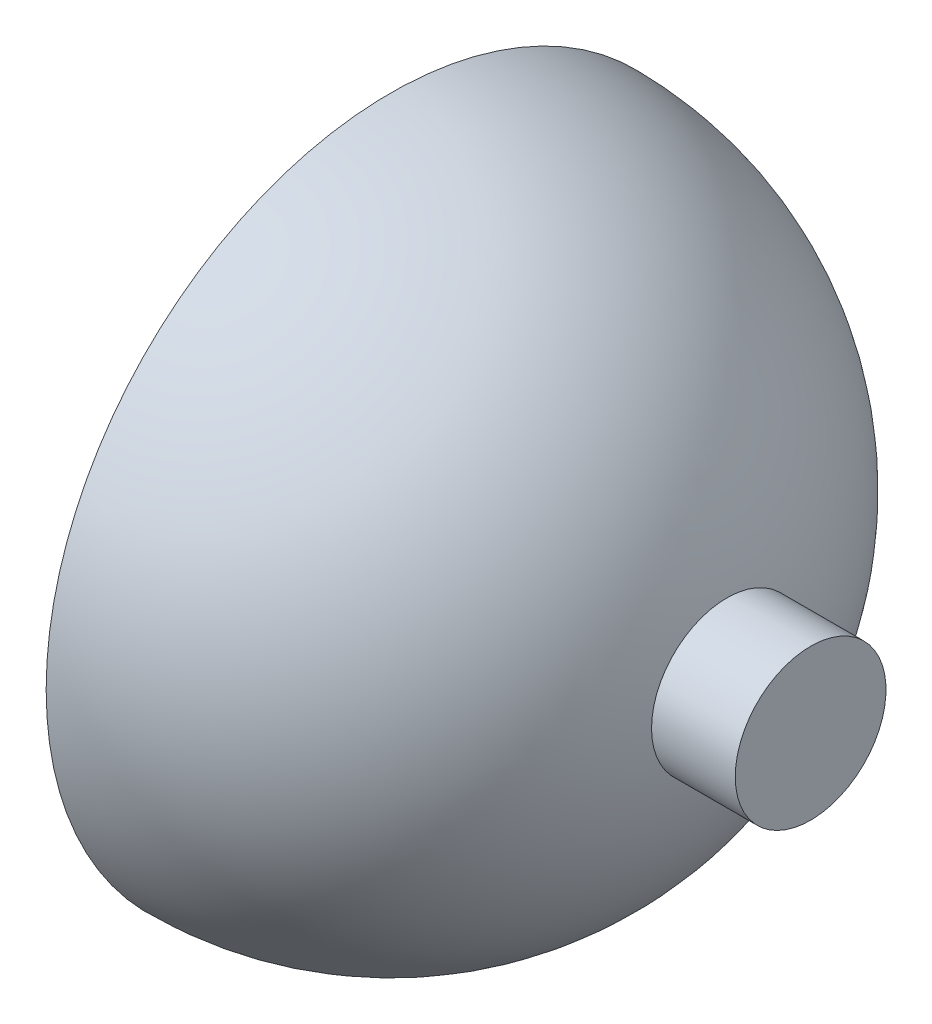
from build123d import *


with BuildPart() as part:
    # Sketch1 → Revolve4 (revolve)
    with BuildSketch(Plane.XY, mode=Mode.PRIVATE) as revolve4_sk:
        with BuildLine():
            ThreePointArc((0, 28.38), (20.06769045, 20.06769045), (28.38, 0))
            Line((28.38, 0), (32, 0))
            Line((32, 0), (39, 0))
            Line((39, 0), (39, 7))
            Line((39, 7), (31.224989992, 7))
            ThreePointArc((31.224989992, 7), (20, 24.979991994), (0, 32))
            Line((0, 32), (0, 28.38))
        make_face()
    revolve(revolve4_sk.sketch.rotate(Axis((0, 0, 0), (1, 0, 0)), 90), axis=Axis((0, 0, 0), (1, 0, 0)))


solid = part.part
